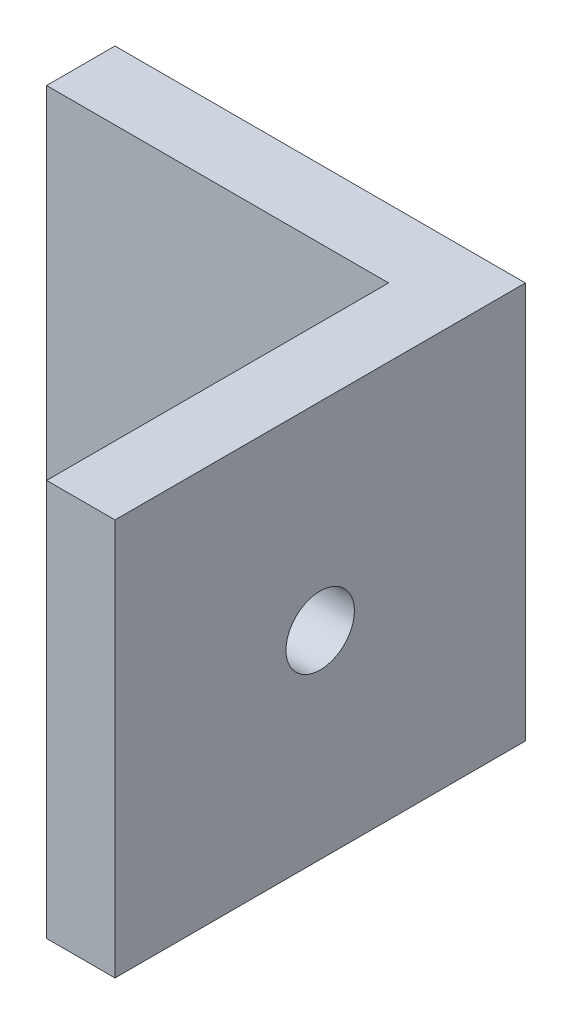
from build123d import *

# Parameters (mm, degrees)
SKETCH1_W           = 38.1
SKETCH1_H           = 38.1
BOSS_EXTRUDE1_DEPTH = 36.83
SKETCH2_W           = 31.75
SKETCH2_H           = 31.75
CUT_EXTRUDE1_DEPTH  = 66.266139
SKETCH4_R           = 3.175
CUT_EXTRUDE2_DEPTH  = 62.774763456
SKETCH3_R           = 3.175
CUT_EXTRUDE3_DEPTH  = 62.774763456


with BuildPart() as part:
    # Sketch1 → Boss-Extrude1 (new body)
    with BuildSketch(Plane(origin=(0, 0, 0), x_dir=(1, 0, 0), z_dir=(0, 1, 0))):
        with Locations((19.05, 19.05)):
            Rectangle(SKETCH1_W, SKETCH1_H)
    extrude(amount=BOSS_EXTRUDE1_DEPTH)

    # Sketch2 → Cut-Extrude1 (cut, through all)
    with BuildSketch(Plane(origin=(0, 36.83, 0), x_dir=(1, 0, 0), z_dir=(0, 1, 0))):
        with Locations((15.875, 15.875)):
            Rectangle(SKETCH2_W, SKETCH2_H)
    extrude(amount=-CUT_EXTRUDE1_DEPTH, mode=Mode.SUBTRACT)

    # Sketch4 → Cut-Extrude2 (cut, through all)
    with BuildSketch(Plane.ZY.offset(-31.75)):
        with Locations((-19.05, 18.415)):
            Circle(SKETCH4_R)
    extrude(amount=-CUT_EXTRUDE2_DEPTH, mode=Mode.SUBTRACT)

    # Sketch3 → Cut-Extrude3 (cut, through all)
    with BuildSketch(Plane.XY.offset(-31.75)):
        with Locations((19.05, 18.415)):
            Circle(SKETCH3_R)
    extrude(amount=-CUT_EXTRUDE3_DEPTH, mode=Mode.SUBTRACT)


solid = part.part
